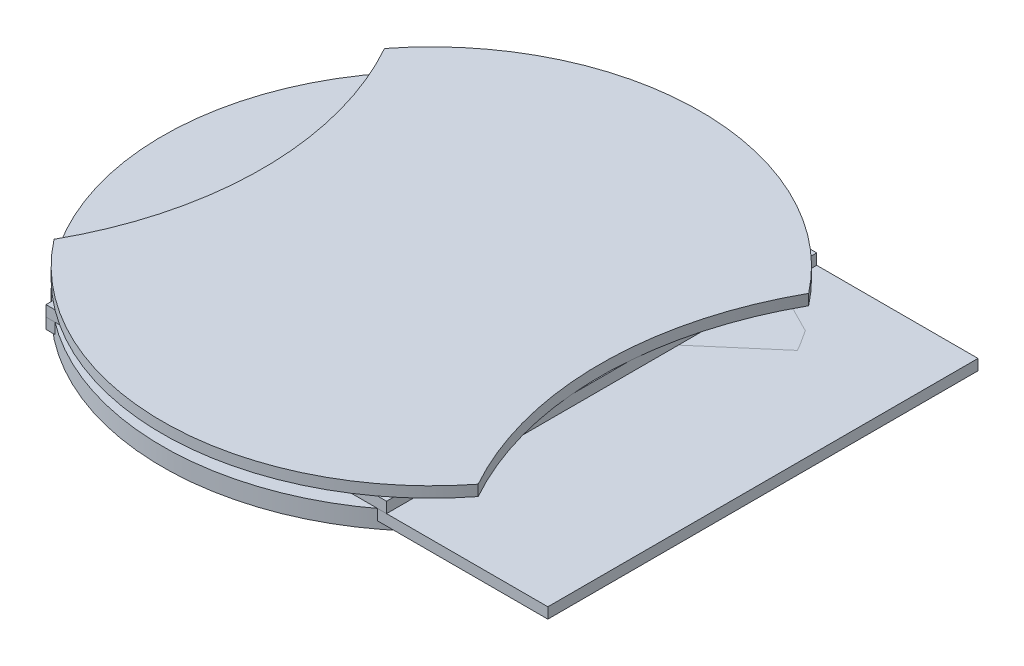
from build123d import *

# Parameters (mm, degrees)
SKETCH1_W                   = 140
SKETCH1_H                   = 120
COMPACT_DEPTH               = 3
SKETCH4_W                   = 95
SKETCH4_H                   = 120
SUPERCOMPACT_DEPTH          = 3
SKETCH7_R                   = 75
APPLE_BASE_DEPTH            = 3
SIDECUTS_DEPTH              = 195.694632694
APPLE_BASE_2_DEPTH          = 3
BOSS_EXTRUDE4_DEPTH         = 3
BASE_PLATE_FILLET_R         = 0.001
TOP_BOTTOM_EXTENSIONS_DEPTH = 3
SKETCH35_R                  = 1.25
SPACERHOLES_DEPTH           = 10
CUT_EXTRUDE4_DEPTH          = 10
SKETCH39_R                  = 75
SKETCH39_R_2                = 1.25
BOSS_EXTRUDE5_DEPTH         = 5
CUT_EXTRUDE5_DEPTH          = 150
SKETCH41_R                  = 8.5
CUT_EXTRUDE6_DEPTH          = 10
SKETCH44_R                  = 8.5
CUT_EXTRUDE7_DEPTH          = 10


with BuildPart() as part:
    # Sketch1 → Compact (new body)
    with BuildSketch(Plane(origin=(0, 0, 0), x_dir=(1, 0, 0), z_dir=(0, 1, 0))):
        with Locations((70, 60)):
            Rectangle(SKETCH1_W, SKETCH1_H)
    extrude(amount=COMPACT_DEPTH)


with BuildPart() as body_2:
    # Sketch4 → SuperCompact (new body)
    with BuildSketch(Plane(origin=(0, 3, 0), x_dir=(1, 0, 0), z_dir=(0, 1, 0))):
        with Locations((47.5, 60)):
            Rectangle(SKETCH4_W, SKETCH4_H)
    extrude(amount=SUPERCOMPACT_DEPTH)


with BuildPart() as body_3:
    # Sketch7 → Apple Base (new body)
    with BuildSketch(Plane(origin=(0, 6, 0), x_dir=(1, 0, 0), z_dir=(0, 1, 0))):
        with Locations(Location((47.5, 60, 0), (0, 0, 270))):
            Circle(SKETCH7_R)
    extrude(amount=APPLE_BASE_DEPTH)

    # Sketch8 → SideCuts (cut, through all)
    with BuildSketch(Plane(origin=(0, 9, 0), x_dir=(1, 0, 0), z_dir=(0, 1, 0))):
        with BuildLine():
            ThreePointArc((-11.66, 106.098746187), (0.350007958, 60), (-11.66, 13.901253813))
            ThreePointArc((-11.66, 13.901253813), (-27.5, 60), (-11.66, 106.098746187))
        make_face()
        with BuildLine():
            ThreePointArc((106.66, 106.098746187), (94.649992042, 60), (106.66, 13.901253813))
            ThreePointArc((106.66, 13.901253813), (122.5, 60), (106.66, 106.098746187))
        make_face()
    extrude(amount=-SIDECUTS_DEPTH, mode=Mode.SUBTRACT)


with BuildPart() as body_4:
    # Sketch9 → Apple_Base 2 (new body)
    with BuildSketch(Plane.XZ.offset(-6)):
        with BuildLine():
            ThreePointArc((106.66, -13.901253813), (47.5, 15), (-11.66, -13.901253813))
            ThreePointArc((-11.66, -13.901253813), (0.350007958, -60), (-11.66, -106.098746187))
            ThreePointArc((-11.66, -106.098746187), (47.5, -135), (106.66, -106.098746187))
            ThreePointArc((106.66, -106.098746187), (94.649992042, -60), (106.66, -13.901253813))
        make_face()
    extrude(amount=APPLE_BASE_2_DEPTH)

    # Sketch10 → Boss-Extrude4 (add)
    with BuildSketch(Plane(origin=(0, 6, 0), x_dir=(1, 0, 0), z_dir=(0, 1, 0))):
        with BuildLine():
            Line((-11.66, 106.098746187), (-11.66, 13.901253813))
            ThreePointArc((-11.66, 13.901253813), (0.350007958, 60), (-11.66, 106.098746187))
        make_face()
        with BuildLine():
            Line((106.66, 106.098746187), (106.66, 13.901253813))
            ThreePointArc((106.66, 13.901253813), (94.649992042, 60), (106.66, 106.098746187))
        make_face()
    extrude(amount=-BOSS_EXTRUDE4_DEPTH)

    # Base_Plate_Fillet
    base_plate_fillet_edges = [body_4.edges().sort_by_distance(p)[0] for p in [
        (-11.66, 3, -60),
        (-11.66, 6, -60),
        (47.5, 3, -135),
        (106.66, 3, -60),
        (106.66, 6, -60),
        (47.5, 6, -135),
        (47.5, 6, 15),
        (106.66, 4.5, -106.098746187),
        (-11.66, 4.5, -106.098746187),
        (-11.66, 4.5, -13.901253813),
        (106.66, 4.5, -13.901253813),
        (47.5, 3, 15),
    ]]
    fillet(base_plate_fillet_edges, radius=BASE_PLATE_FILLET_R)

    # Sketch25 → Top Bottom extensions (add)
    with BuildSketch(Plane(origin=(0, 6, 0), x_dir=(1, 0, 0), z_dir=(0, 1, 0))):
        with BuildLine():
            Line((-11.659005821, 106.097402592), (-11.659005821, 111.097402592))
            ThreePointArc((-11.659005821, 111.097402592), (47.5, 138.794628322), (106.659005821, 111.097402592))
            Line((106.659005821, 111.097402592), (106.659005821, 106.097402592))
            ThreePointArc((106.659005821, 106.097402592), (47.5, 133.794628322), (-11.659005821, 106.097402592))
        make_face()
        with BuildLine():
            Line((106.659005821, 13.902597408), (106.659005821, 8.902597408))
            ThreePointArc((106.659005821, 8.902597408), (47.5, -18.794628322), (-11.659005821, 8.902597408))
            Line((-11.659005821, 8.902597408), (-11.659005821, 13.902597408))
            ThreePointArc((-11.659005821, 13.902597408), (47.5, -13.794628322), (106.659005821, 13.902597408))
        make_face()
    extrude(amount=-TOP_BOTTOM_EXTENSIONS_DEPTH)

    # Sketch35 → SpacerHoles (cut)
    with BuildSketch(Plane.XZ.offset(-3)):
        with Locations(Location((7.5, -5.15, 0), (0, 0, 270))):
            Circle(SKETCH35_R)
        with Locations(Location((87.5, -5.15, 0), (0, 0, 270))):
            Circle(SKETCH35_R)
        with Locations(Location((87.5, -114.85, 0), (0, 0, 270))):
            Circle(SKETCH35_R)
        with Locations(Location((7.5, -114.85, 0), (0, 0, 270))):
            Circle(SKETCH35_R)
    extrude(amount=-SPACERHOLES_DEPTH, mode=Mode.SUBTRACT)

    # Sketch38 → Cut-Extrude4 (cut)
    with BuildSketch(Plane.XZ.offset(-3)):
        Polygon((47.5, 37.050137759), (120.372278362, 37.050137759), (120.372278362, -158.601845129), (-29.177494987, -158.601845129), (-29.177494987, 37.050137759), align=None)
        Polygon((-6.659, -60), (-6.659, 24.702355976), (101.659, 24.702355976), (101.659, -143.843523469), (-6.659, -143.843523469), align=None, mode=Mode.SUBTRACT)
    extrude(amount=-CUT_EXTRUDE4_DEPTH, mode=Mode.SUBTRACT)

    # Sketch39 → Boss-Extrude5 (add)
    with BuildSketch(Plane.XZ.offset(-3)):
        with Locations(Location((47.5, -60, 0), (0, 0, 43.770209918))):
            Circle(SKETCH39_R)
        with Locations(Location((87.5, -5.15, 0), (0, 0, 270))):
            Circle(SKETCH39_R_2, mode=Mode.SUBTRACT)
        with Locations(Location((7.5, -5.15, 0), (0, 0, 270))):
            Circle(SKETCH39_R_2, mode=Mode.SUBTRACT)
        with Locations(Location((7.5, -114.85, 0), (0, 0, 270))):
            Circle(SKETCH39_R_2, mode=Mode.SUBTRACT)
        with Locations(Location((87.5, -114.85, 0), (0, 0, 270))):
            Circle(SKETCH39_R_2, mode=Mode.SUBTRACT)
    extrude(amount=BOSS_EXTRUDE5_DEPTH)

    # Sketch40 → Cut-Extrude5 (cut)
    with BuildSketch(Plane(origin=(101.659, 0, 0), x_dir=(0, 0, -1), z_dir=(1, 0, 0))):
        Polygon((3.460058054, 3), (-22.733784582, 3), (-22.733784582, 8.214035789), (147.50303534, 8.214035789), (147.50303534, 3), align=None)
    extrude(amount=-CUT_EXTRUDE5_DEPTH, mode=Mode.SUBTRACT)

    # Sketch41 → Cut-Extrude6 (cut)
    with BuildSketch(Plane(origin=(0, 3, 0), x_dir=(1, 0, 0), z_dir=(0, 1, 0))):
        with Locations(Location((47.5, 60, 0), (0, 0, 270))):
            Circle(SKETCH41_R)
    extrude(amount=-CUT_EXTRUDE6_DEPTH, mode=Mode.SUBTRACT)

    # Sketch44 → Cut-Extrude7 (cut)
    with BuildSketch(Plane(origin=(0, 3, 0), x_dir=(1, 0, 0), z_dir=(0, 1, 0))):
        with Locations(Location((107.5, 60, 0), (0, 0, 270))):
            Circle(SKETCH44_R)
    extrude(amount=-CUT_EXTRUDE7_DEPTH, mode=Mode.SUBTRACT)


solid = Compound([part.part, body_2.part, body_3.part, body_4.part])
